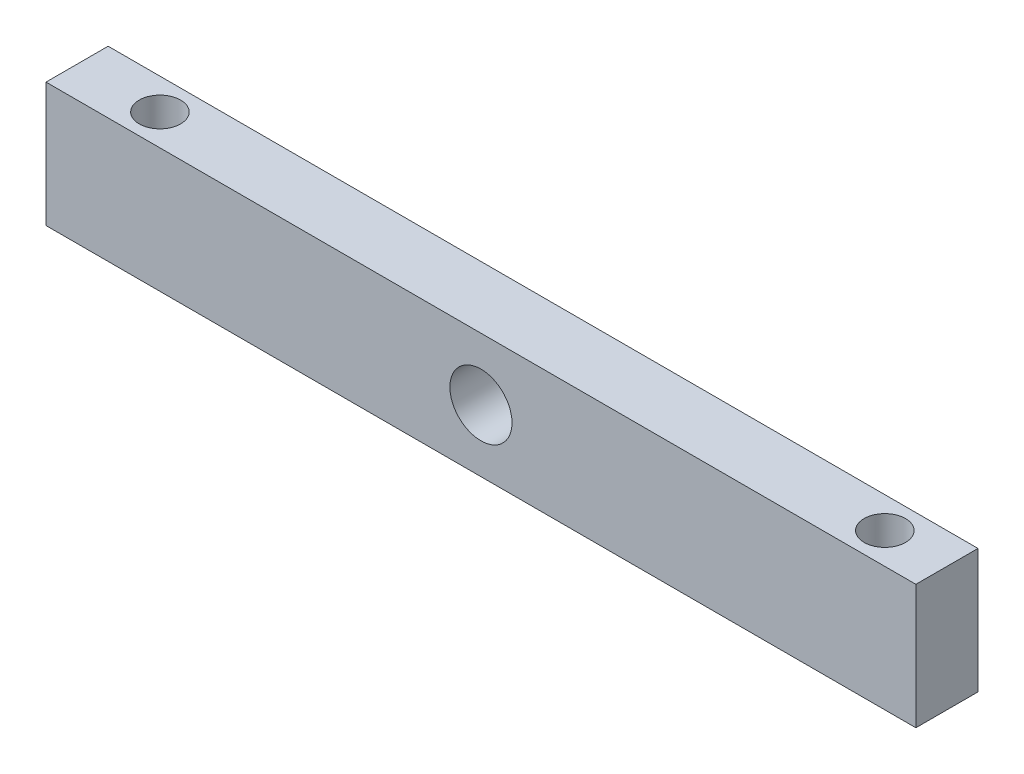
from build123d import *

# Parameters (mm, degrees)
RESSALTO_EXTRUS_O1_DEPTH = 15
CORTE_EXTRUS_O1_DEPTH    = 15
ESBO_O3_R                = 5
CORTE_EXTRUS_O2_DEPTH    = 30


with BuildPart() as part:
    # Esboço1 → Ressalto-extrusão1 (new body)
    with BuildSketch(Plane.XY):
        Polygon((0, 0), (60, 0), (60, 30), (-150, 30), (-150, 0), align=None)
    extrude(amount=RESSALTO_EXTRUS_O1_DEPTH)

    # Esboço2 → Corte-extrusão1 (cut)
    with BuildSketch(Plane.XY.offset(15)):
        with BuildLine():
            ThreePointArc((-45, 22.5), (-52.5, 15), (-45, 7.5))
            Line((-45, 7.5), (-45, 22.5))
        make_face()
        with BuildLine():
            Line((-45, 22.5), (-45, 7.5))
            ThreePointArc((-45, 7.5), (-39.696699141, 9.696699141), (-37.5, 15))
            ThreePointArc((-37.5, 15), (-39.696699141, 20.303300859), (-45, 22.5))
        make_face()
    extrude(amount=-CORTE_EXTRUS_O1_DEPTH, mode=Mode.SUBTRACT)

    # Esboço3 → Corte-extrusão2 (cut)
    with BuildSketch(Plane(origin=(0, 0, 0), x_dir=(-1, 0, 0), z_dir=(0, -1, 0))):
        with Locations(Location((130, -7.5, 0), (0, 0, 90))):
            Circle(ESBO_O3_R)
        with Locations(Location((-45, -7.5, 0), (0, 0, 90))):
            Circle(ESBO_O3_R)
    extrude(amount=-CORTE_EXTRUS_O2_DEPTH, mode=Mode.SUBTRACT)


solid = part.part
